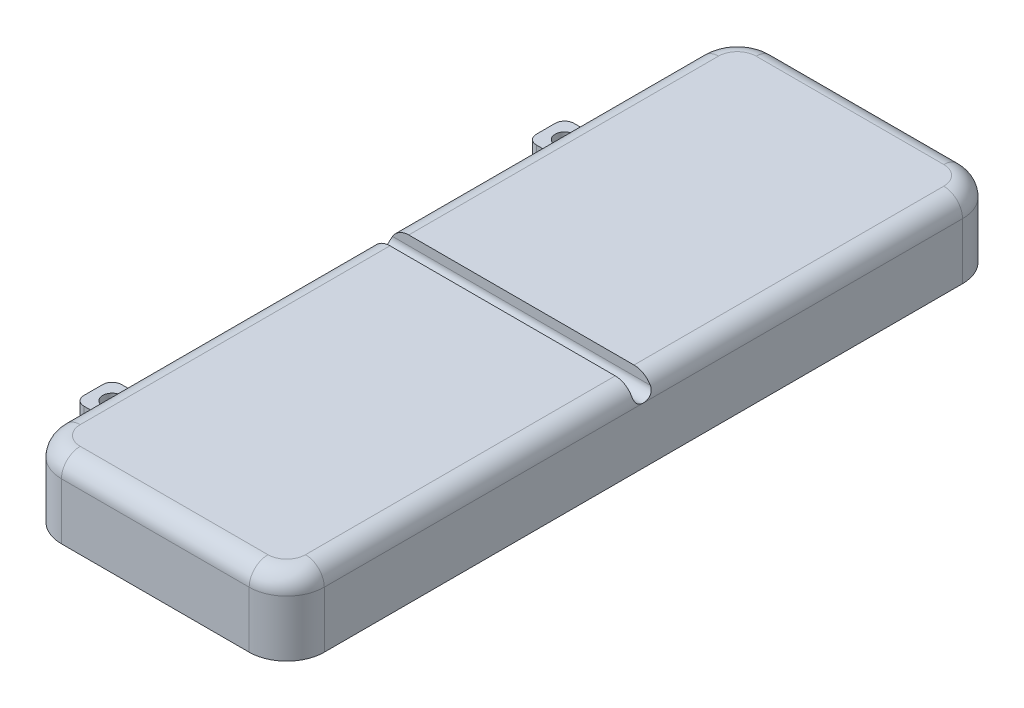
from build123d import *

# Parameters (mm, degrees)
BOSS_EXTRUDE1_DEPTH  = 10.16
SKETCH3_R            = 1.27
CUT_EXTRUDE1_DEPTH   = 10.16
SKETCH4_W            = 8.255
SKETCH4_H            = 7.62
CUT_EXTRUDE2_DEPTH   = 10.16
FILLET2_R            = 0.508
FILLET3_R            = 1.27
SKETCH6_W            = 84.495652993
SKETCH6_H            = 50.182540269
CUT_EXTRUDE3_DEPTH   = 27.94
CUT_EXTRUDE4_DEPTH   = 27.94
CUT_EXTRUDE5_DEPTH   = 40.132
FILLET4_R            = 2.54
FILLET2_OF_MIRROR1_R = 0.508
FILLET3_OF_MIRROR1_R = 1.27
FILLET4_OF_MIRROR1_R = 2.54


with BuildPart() as part:
    # Sketch1 → Boss-Extrude1 (new body)
    with BuildSketch(Plane(origin=(0, 0, 0), x_dir=(1, 0, 0), z_dir=(0, 1, 0))):
        with BuildLine():
            Line((-58.188733064, -33.517116066), (5.311266936, -33.517116066))
            Line((5.311266936, -33.517116066), (5.311266936, 14.742883934))
            Line((5.311266936, 14.742883934), (-53.108733064, 14.742883934))
            ThreePointArc((-53.108733064, 14.742883934), (-56.700835512, 13.254986382), (-58.188733064, 9.662883934))
            Line((-58.188733064, 9.662883934), (-58.188733064, -0.370116066))
            Line((-58.188733064, -0.370116066), (-66.443733064, -0.370116066))
            Line((-66.443733064, -0.370116066), (-66.443733064, -5.450116066))
            Line((-66.443733064, -5.450116066), (-58.188733064, -5.450116066))
            Line((-58.188733064, -5.450116066), (-58.188733064, -33.517116066))
        make_face()
    boss_extrude1 = extrude(amount=BOSS_EXTRUDE1_DEPTH)

    # Sketch3 → Cut-Extrude1 (cut)
    with BuildSketch(Plane(origin=(0, 10.16, 0), x_dir=(1, 0, 0), z_dir=(0, 1, 0))):
        with Locations(Location((-63.903733064, -2.910116066, 0), (0, 0, 270))):
            Circle(SKETCH3_R)
    cut_extrude1 = extrude(amount=-CUT_EXTRUDE1_DEPTH, mode=Mode.SUBTRACT)

    # Sketch4 → Cut-Extrude2 (cut)
    with BuildSketch(Plane.XY.offset(5.450116066)):
        with Locations((-62.316233064, 6.35)):
            Rectangle(SKETCH4_W, SKETCH4_H)
    cut_extrude2 = extrude(amount=-CUT_EXTRUDE2_DEPTH, mode=Mode.SUBTRACT)

    # Fillet2
    fillet2_edges = [part.edges().sort_by_distance(p)[0] for p in [
        (-58.188733064, 1.27, 5.450116066),
        (-58.188733064, 1.27, 0.370116066),
        (-58.188733064, 2.54, 2.910116066),
    ]]
    fillet(fillet2_edges, radius=FILLET2_R)

    # Fillet3
    fillet3_edges = [part.edges().sort_by_distance(p)[0] for p in [
        (-66.443733064, 1.27, 5.450116066),
        (-66.443733064, 1.27, 0.370116066),
    ]]
    fillet(fillet3_edges, radius=FILLET3_R)

    # Sketch6 → Cut-Extrude3 (cut)
    with BuildSketch(Plane(origin=(5.311266936, 0, 0), x_dir=(0, 0, -1), z_dir=(1, 0, 0))):
        with Locations((-10.301713583, -2.397336113)):
            Rectangle(SKETCH6_W, SKETCH6_H)
    cut_extrude3 = extrude(amount=-CUT_EXTRUDE3_DEPTH, mode=Mode.SUBTRACT)

    # Sketch7 → Cut-Extrude4 (cut)
    with BuildSketch(Plane(origin=(0, 10.16, 0), x_dir=(1, 0, 0), z_dir=(0, 1, 0))):
        with BuildLine():
            Line((-22.628733064, 14.742883934), (-27.708733064, 14.742883934))
            ThreePointArc((-27.708733064, 14.742883934), (-24.116630616, 13.254986382), (-22.628733064, 9.662883934))
            Line((-22.628733064, 9.662883934), (-22.628733064, 14.742883934))
        make_face()
    cut_extrude4 = extrude(amount=-CUT_EXTRUDE4_DEPTH, mode=Mode.SUBTRACT)

    # Sketch8 → Cut-Extrude5 (cut)
    with BuildSketch(Plane.ZY.offset(58.188733064)):
        with BuildLine():
            Line((33.517116066, 10.16), (33.517116066, 8.89))
            Line((33.517116066, 8.89), (33.517116066, 7.62))
            ThreePointArc((33.517116066, 7.62), (32.619090454, 7.991974388), (32.247116066, 8.89))
            Line((32.247116066, 8.89), (32.247116066, 10.16))
            Line((32.247116066, 10.16), (33.517116066, 10.16))
        make_face()
    cut_extrude5 = extrude(amount=-CUT_EXTRUDE5_DEPTH, mode=Mode.SUBTRACT)

    # Fillet4
    fillet4_edges = [part.edges().sort_by_distance(p)[0] for p in [
        (-24.116630616, 10.16, -13.254986382),
        (-22.628733064, 10.16, 11.292116066),
        (-40.408733064, 10.16, -14.742883934),
        (-56.700835512, 10.16, -13.254986382),
        (-58.188733064, 10.16, 11.292116066),
    ]]
    fillet(fillet4_edges, radius=FILLET4_R)


with BuildPart() as mirror1_1:
    # Mirror1: Boss-Extrude1 across plane
    add(boss_extrude1.mirror(Plane(origin=(-58.188733064, 10.16, 33.517116066), x_dir=(1, 0, 0), z_dir=(0, 0, -1))))

    # Mirror1 2: Cut-Extrude1, Cut-Extrude2, Cut-Extrude3, Cut-Extrude4, Cut-Extrude5 across plane
    add(cut_extrude1.mirror(Plane(origin=(-58.188733064, 10.16, 33.517116066), x_dir=(1, 0, 0), z_dir=(0, 0, -1))), mode=Mode.SUBTRACT)
    add(cut_extrude2.mirror(Plane(origin=(-58.188733064, 10.16, 33.517116066), x_dir=(1, 0, 0), z_dir=(0, 0, -1))), mode=Mode.SUBTRACT)
    add(cut_extrude3.mirror(Plane(origin=(-58.188733064, 10.16, 33.517116066), x_dir=(1, 0, 0), z_dir=(0, 0, -1))), mode=Mode.SUBTRACT)
    add(cut_extrude4.mirror(Plane(origin=(-58.188733064, 10.16, 33.517116066), x_dir=(1, 0, 0), z_dir=(0, 0, -1))), mode=Mode.SUBTRACT)
    add(cut_extrude5.mirror(Plane(origin=(-58.188733064, 10.16, 33.517116066), x_dir=(1, 0, 0), z_dir=(0, 0, -1))), mode=Mode.SUBTRACT)

    # Fillet2 of Mirror1
    fillet2_of_mirror1_edges = [mirror1_1.edges().sort_by_distance(p)[0] for p in [
        (-58.188733064, 1.27, 61.584116066),
        (-58.188733064, 1.27, 66.664116066),
        (-58.188733064, 2.54, 64.124116066),
    ]]
    fillet(fillet2_of_mirror1_edges, radius=FILLET2_OF_MIRROR1_R)

    # Fillet3 of Mirror1
    fillet3_of_mirror1_edges = [mirror1_1.edges().sort_by_distance(p)[0] for p in [
        (-66.443733064, 1.27, 61.584116066),
        (-66.443733064, 1.27, 66.664116066),
    ]]
    fillet(fillet3_of_mirror1_edges, radius=FILLET3_OF_MIRROR1_R)

    # Fillet4 of Mirror1
    fillet4_of_mirror1_edges = [mirror1_1.edges().sort_by_distance(p)[0] for p in [
        (-24.116630616, 10.16, 80.289218515),
        (-22.628733064, 10.16, 55.742116066),
        (-40.408733064, 10.16, 81.777116066),
        (-56.700835512, 10.16, 80.289218515),
        (-58.188733064, 10.16, 55.742116066),
    ]]
    fillet(fillet4_of_mirror1_edges, radius=FILLET4_OF_MIRROR1_R)


with BuildPart() as part_1:
    add(part.part)

    # Mirror1 united with what the copies touc: union Mirror1_1
    add(mirror1_1.part)


solid = part_1.part
